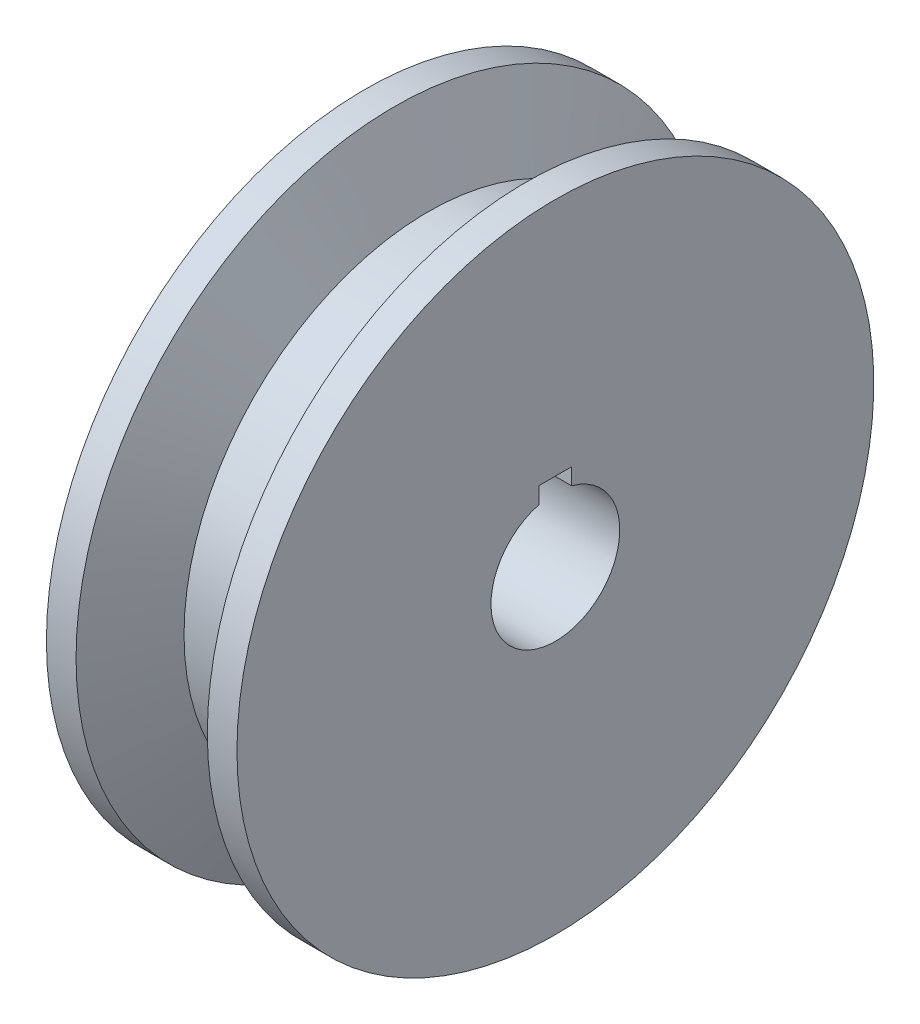
from build123d import *

# Parameters (mm, degrees)
CUT_EXTRUDE1_REACH = 76.623


with BuildPart() as part:
    # Sketch1 → Revolve1 (revolve)
    with BuildSketch(Plane.XY, mode=Mode.PRIVATE) as revolve1_sk:
        Polygon((31.75, 9.652), (0, 9.652), (0, 15.875), (3.175, 15.875), (3.175, 47.752), (7.62, 47.752), (12.7, 36.6395), (22.225, 36.6395), (27.305, 47.752), (31.75, 47.752), align=None)
    revolve(revolve1_sk.sketch.rotate(Axis((0, 0, 0), (1, 0, 0)), 90), axis=Axis((0, 0, 0), (1, 0, 0)))

    # Sketch2 → Cut-Extrude1 (cut, up to next)
    with BuildSketch(Plane.ZY, mode=Mode.PRIVATE) as cut_extrude1_sk1:
        with BuildLine():
            Line((-2.4384, 9.338913718), (-2.4384, 11.811))
            Line((-2.4384, 11.811), (2.4384, 11.811))
            Line((2.4384, 11.811), (2.4384, 9.338913718))
            ThreePointArc((2.4384, 9.338913718), (0, 9.652), (-2.4384, 9.338913718))
        make_face()
    cut_extrude1_tool1 = extrude(cut_extrude1_sk1.sketch, amount=-CUT_EXTRUDE1_REACH, mode=Mode.PRIVATE) & part.part
    add(cut_extrude1_tool1.solids().sort_by_distance((0, 10.677746, 0))[0], mode=Mode.SUBTRACT)


solid = part.part
